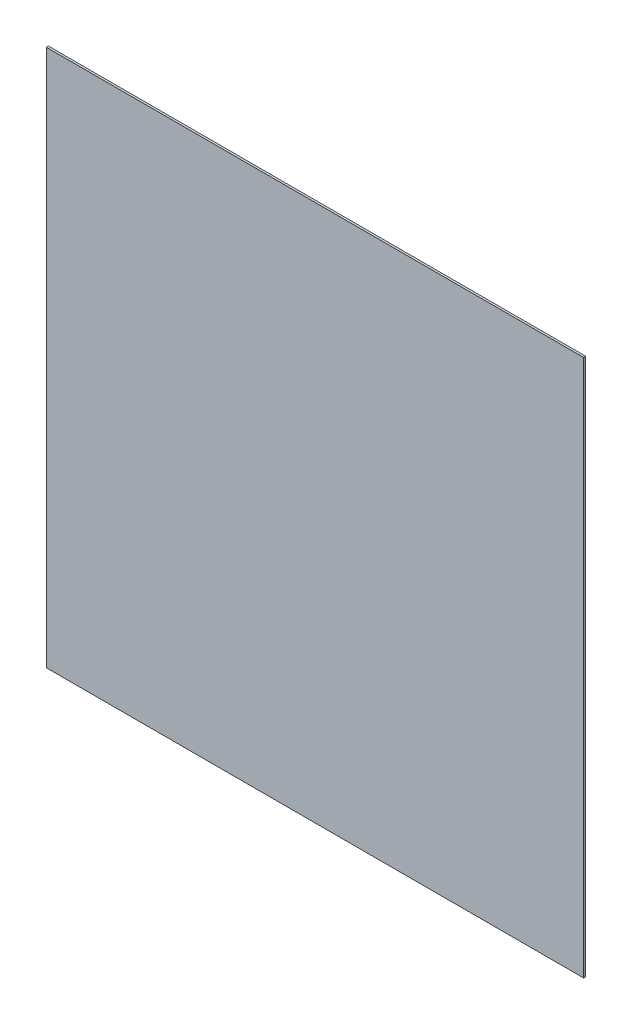
from build123d import *

# Parameters (mm, degrees)
SKETCH_1_W  = 100
SKETCH_1_H  = 100
BOARD_DEPTH = 0.39116


with BuildPart() as part:
    # 草圖1 → Board (new body)
    with BuildSketch(Plane.XY):
        with Locations((75.4, 75.4)):
            Rectangle(SKETCH_1_W, SKETCH_1_H)
    extrude(amount=BOARD_DEPTH)


solid = part.part
